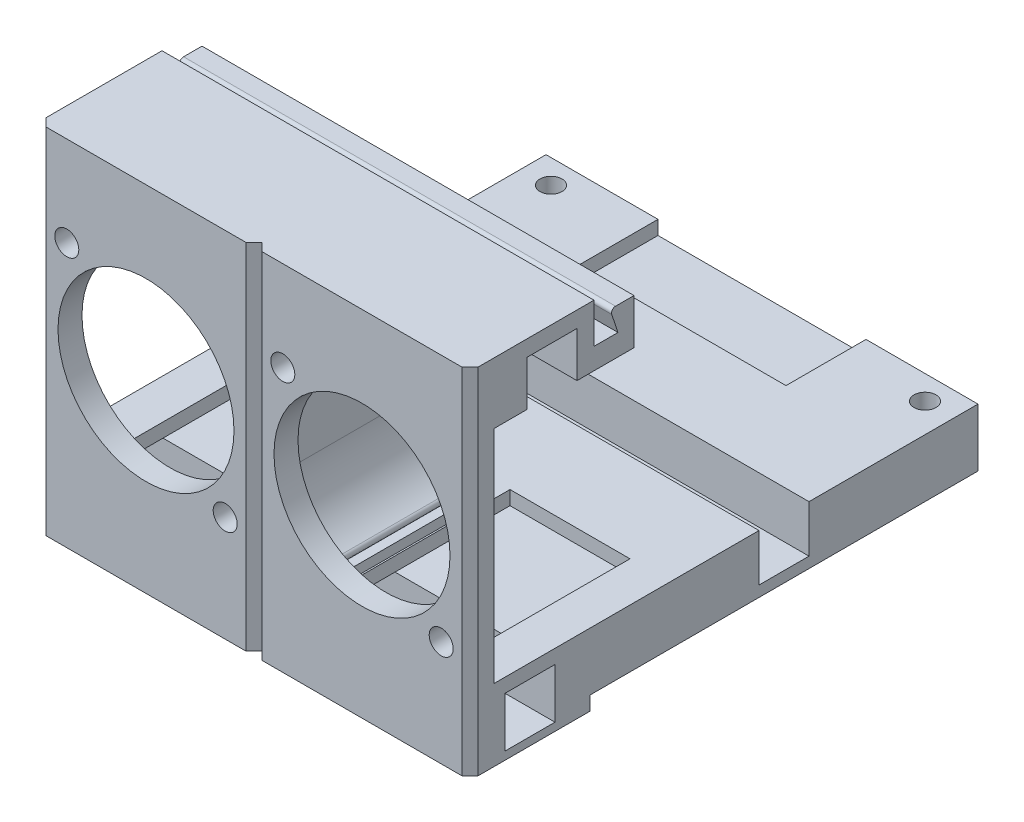
from build123d import *

# Parameters (mm, degrees)
SKETCH1_W           = 54
SKETCH1_H           = 63.5
SKETCH1_R           = 1.375
BOSS_EXTRUDE1_DEPTH = 9
SKETCH2_W           = 54
SKETCH2_H           = 3
BOSS_EXTRUDE2_DEPTH = 35.25
SKETCH3_R           = 11
SKETCH3_R_2         = 1.5
CUT_EXTRUDE1_DEPTH  = 82.9714127
SKETCH4_W           = 54
SKETCH4_H           = 48.5
CUT_EXTRUDE2_DEPTH  = 1.75
BOSS_EXTRUDE3_DEPTH = 17.5
SKETCH6_W           = 54
SKETCH6_H           = 7.65
BOSS_EXTRUDE5_DEPTH = 17.5
FILLET2_R           = 3
SKETCH8_W           = 15
SKETCH8_H           = 22
SKETCH8_W_2         = 26
SKETCH8_H_2         = 10
CUT_EXTRUDE4_DEPTH  = 1.75
SKETCH7_W           = 6.25
SKETCH7_H           = 6.25
SKETCH7_H_2         = 5.9
CUT_EXTRUDE3_DEPTH  = 77.695012876
CHAMFER2_SIZE       = 1
CUT_EXTRUDE5_DEPTH  = 61.787539842
CUT_EXTRUDE6_DEPTH  = 77.695012876
BOSS_EXTRUDE6_START = 0.2
SKETCH13_W          = 8.680886663
SKETCH13_H          = 18.174047098
BOSS_EXTRUDE6_DEPTH = 1.2


with BuildPart() as part:
    # Sketch1 → Boss-Extrude1 (new body)
    with BuildSketch(Plane(origin=(0, 0, 0), x_dir=(1, 0, 0), z_dir=(0, 1, 0))):
        Rectangle(SKETCH1_W, SKETCH1_H)
        with Locations(Location((-23.375, 28.75, 0), (0, 0, 270))):
            Circle(SKETCH1_R, mode=Mode.SUBTRACT)
        with Locations(Location((23.375, 28.75, 0), (0, 0, 270))):
            Circle(SKETCH1_R, mode=Mode.SUBTRACT)
        with Locations(Location((0, -5.5, 0), (0, 0, 270))):
            Circle(SKETCH1_R, mode=Mode.SUBTRACT)
    extrude(amount=BOSS_EXTRUDE1_DEPTH)

    # Sketch2 → Boss-Extrude2 (add)
    with BuildSketch(Plane(origin=(0, 9, 0), x_dir=(1, 0, 0), z_dir=(0, 1, 0))):
        with Locations((0, -30.25)):
            Rectangle(SKETCH2_W, SKETCH2_H)
    extrude(amount=BOSS_EXTRUDE2_DEPTH)

    # Sketch3 → Cut-Extrude1 (cut, through all)
    with BuildSketch(Plane.XY.offset(31.75)):
        with Locations((-13.5, 23.1)):
            Circle(SKETCH3_R)
        with Locations((13.5, 23.1)):
            Circle(SKETCH3_R)
        with Locations((-23.4, 33)):
            Circle(SKETCH3_R_2)
        with Locations((-3.6, 13.2)):
            Circle(SKETCH3_R_2)
        with Locations((3.6, 33)):
            Circle(SKETCH3_R_2)
        with Locations((23.4, 13.2)):
            Circle(SKETCH3_R_2)
    extrude(amount=-CUT_EXTRUDE1_DEPTH, mode=Mode.SUBTRACT)

    # Sketch4 → Cut-Extrude2 (cut)
    with BuildSketch(Plane(origin=(0, 0, 0), x_dir=(-1, 0, 0), z_dir=(0, -1, 0))):
        with Locations((0, 7.5)):
            Rectangle(SKETCH4_W, SKETCH4_H)
    extrude(amount=-CUT_EXTRUDE2_DEPTH, mode=Mode.SUBTRACT)

    # Sketch5 → Boss-Extrude3 (add)
    with BuildSketch(Plane(origin=(0, 0, 28.75), x_dir=(-1, 0, 0), z_dir=(0, 0, -1))):
        with BuildLine():
            Line((-1.25, 23.1), (-1.25, 29.841281906))
            ThreePointArc((-1.25, 29.841281906), (-1.147384506, 30.849064124), (-0.84375, 31.815480715))
            ThreePointArc((-0.84375, 31.815480715), (-0.661569296, 32.395330669), (-0.6, 33))
            Line((-0.6, 33), (-0.6, 36.6))
            Line((-0.6, 36.6), (9.4, 36.6))
            ThreePointArc((9.4, 36.6), (3.6714701, 32.206911385), (1.5, 25.322145594))
            Line((1.5, 25.322145594), (1.5, 23.1))
            Line((1.5, 23.1), (1.5, 16.886461718))
            ThreePointArc((1.5, 16.886461718), (1.357339807, 15.700607596), (0.9375, 14.582423144))
            ThreePointArc((0.9375, 14.582423144), (0.685596116, 13.911512474), (0.6, 13.2))
            Line((0.6, 13.2), (0.6, 10.6))
            Line((0.6, 10.6), (0, 10.6))
            Line((0, 10.6), (-5.816699867, 10.6))
            ThreePointArc((-5.816699867, 10.6), (-6.30299863, 10.983752361), (-6.042824199, 11.545945946))
            ThreePointArc((-6.042824199, 11.545945946), (-2.543868689, 14.770850967), (-1.25, 19.35))
            Line((-1.25, 19.35), (-1.25, 23.1))
        make_face()
    extrude(amount=BOSS_EXTRUDE3_DEPTH)

    # Sketch6 → Boss-Extrude5 (add)
    with BuildSketch(Plane(origin=(0, 0, 28.75), x_dir=(-1, 0, 0), z_dir=(0, 0, -1))):
        with Locations((0, 40.425)):
            Rectangle(SKETCH6_W, SKETCH6_H)
    extrude(amount=BOSS_EXTRUDE5_DEPTH)

    # Fillet2
    fillet2_edges = [part.edges().sort_by_distance(p)[0] for p in [
        (-9.4, 36.6, 20),
        (0.6, 36.6, 20),
    ]]
    fillet(fillet2_edges, radius=FILLET2_R)

    # Sketch8 → Cut-Extrude4 (cut)
    with BuildSketch(Plane(origin=(0, 9, 0), x_dir=(1, 0, 0), z_dir=(0, 1, 0))):
        with Locations((14.5, -17.75)):
            Rectangle(SKETCH8_W, SKETCH8_H)
        with Locations((-14.5, -17.75)):
            Rectangle(SKETCH8_W, SKETCH8_H)
        with Locations((0, 26.75)):
            Rectangle(SKETCH8_W_2, SKETCH8_H_2)
    extrude(amount=-CUT_EXTRUDE4_DEPTH, mode=Mode.SUBTRACT)

    # Sketch7 → Cut-Extrude3 (cut, through all)
    with BuildSketch(Plane(origin=(27, 0, 0), x_dir=(0, 0, -1), z_dir=(1, 0, 0))):
        with Locations((-24.25, 4.125)):
            Rectangle(SKETCH7_W, SKETCH7_H)
        with Locations((-21.5, 39.125)):
            Rectangle(SKETCH7_W, SKETCH7_H)
        with Locations((7.5, 6.05)):
            Rectangle(SKETCH7_W, SKETCH7_H_2)
    extrude(amount=-CUT_EXTRUDE3_DEPTH, mode=Mode.SUBTRACT)

    # Chamfer2
    chamfer2_edges = [part.edges().sort_by_distance(p)[0] for p in [
        (27, 22.125, 31.75),
        (-27, 22.125, 31.75),
    ]]
    chamfer(chamfer2_edges, length=CHAMFER2_SIZE)

    # Sketch9 → Cut-Extrude5 (cut, through all)
    with BuildSketch(Plane(origin=(0, 44.25, 0), x_dir=(1, 0, 0), z_dir=(0, 1, 0))):
        Polygon((-1, -31.75), (0, -30.75), (1, -31.75), align=None)
    extrude(amount=-CUT_EXTRUDE5_DEPTH, mode=Mode.SUBTRACT)

    # Sketch10 → Cut-Extrude6 (cut, through all)
    with BuildSketch(Plane(origin=(27, 0, 0), x_dir=(0, 0, -1), z_dir=(1, 0, 0))):
        with BuildLine():
            Line((-11.25, 44.25), (-16.25, 44.25))
            Line((-16.25, 44.25), (-16.25, 39.25))
            Line((-16.25, 39.25), (-13.25, 39.25))
            Line((-13.25, 39.25), (-14.030628706, 41.591886117))
            ThreePointArc((-14.030628706, 41.591886117), (-13.961908149, 42.042355142), (-13.556287057, 42.25))
            Line((-13.556287057, 42.25), (-11.25, 42.25))
            Line((-11.25, 42.25), (-11.25, 44.25))
        make_face()
    extrude(amount=-CUT_EXTRUDE6_DEPTH, mode=Mode.SUBTRACT)


with BuildPart() as body_2:
    # Sketch13 → Boss-Extrude6 (new body)
    with BuildSketch(Plane(origin=(0, 9, 0), x_dir=(1, 0, 0), z_dir=(0, 1, 0)).offset(BOSS_EXTRUDE6_START)):
        with Locations((2.659556669, -19.282754062)):
            Rectangle(SKETCH13_W, SKETCH13_H)
    extrude(amount=BOSS_EXTRUDE6_DEPTH)


solid = Compound([part.part, body_2.part])
